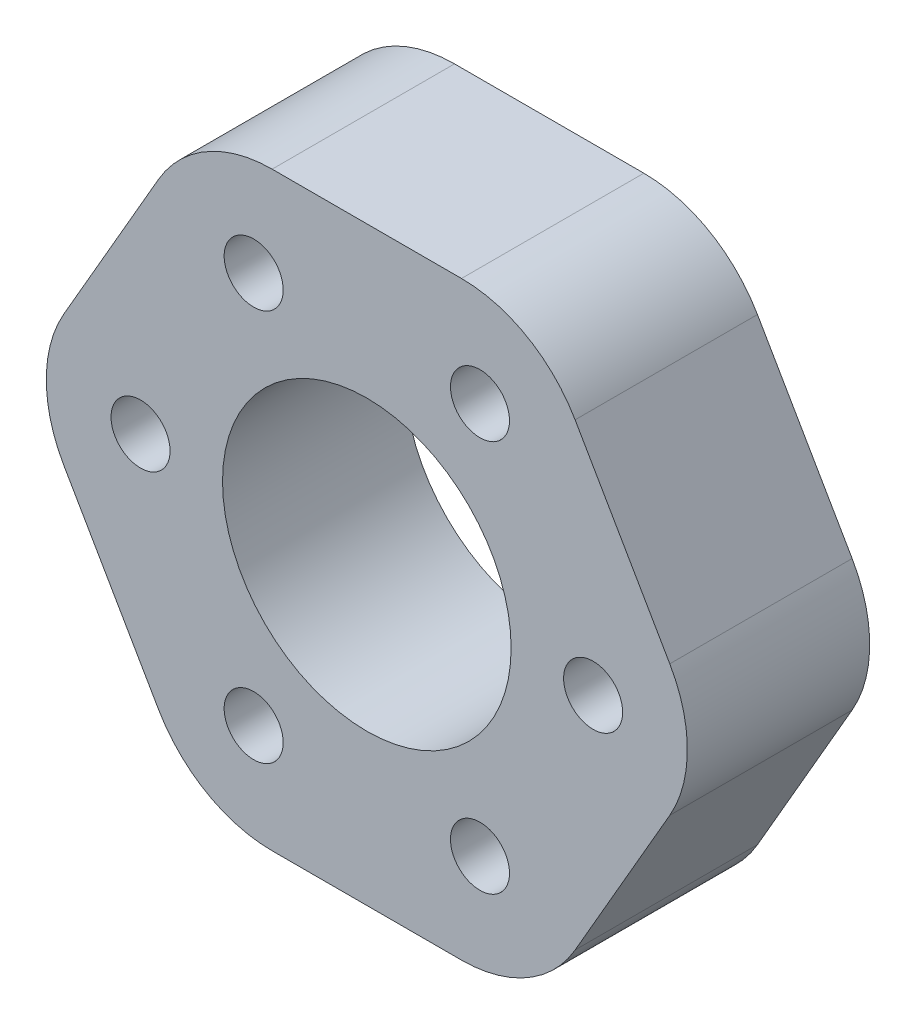
from build123d import *

# Parameters (mm, degrees)
SKETCH_1_R          = 29.4
SKETCH_1_R_2        = 2.25
EXTRUDE_1_DEPTH     = 13.9
SKETCH_2_OUTSIDE_W  = 77.662
SKETCH_2_OUTSIDE_H  = 77.662
SKETCH_2_OUTSIDE_R  = 11
CUT_EXTRUDE_1_DEPTH = 44.83982208
FILLET_1_R          = 10


with BuildPart() as part:
    # 草图1 → 凸台-拉伸1 (new body)
    with BuildSketch(Plane.XY):
        Circle(SKETCH_1_R)
        with Locations((-17.25, 0)):
            Circle(SKETCH_1_R_2, mode=Mode.SUBTRACT)
        with Locations((-8.625, 14.938938215)):
            Circle(SKETCH_1_R_2, mode=Mode.SUBTRACT)
        with Locations((8.625, 14.938938215)):
            Circle(SKETCH_1_R_2, mode=Mode.SUBTRACT)
        with Locations((17.25, 0)):
            Circle(SKETCH_1_R_2, mode=Mode.SUBTRACT)
        with Locations((8.625, -14.938938215)):
            Circle(SKETCH_1_R_2, mode=Mode.SUBTRACT)
        with Locations((-8.625, -14.938938215)):
            Circle(SKETCH_1_R_2, mode=Mode.SUBTRACT)
    extrude(amount=EXTRUDE_1_DEPTH)

    # 草图2 outside → 切除-拉伸1 (cut, through all)
    # profile 1 of 2: a face of its own
    with BuildSketch(Plane.XY.offset(13.9)):
        Rectangle(SKETCH_2_OUTSIDE_W, SKETCH_2_OUTSIDE_H)
        Polygon((12.990381057, 22.5), (-12.990381057, 22.5), (-25.980762114, 0), (-12.990381057, -22.5), (12.990381057, -22.5), (25.980762114, 0), align=None, mode=Mode.SUBTRACT)
    # profile 2 of 2: a face of its own
    with BuildSketch(Plane.XY.offset(13.9)):
        Circle(SKETCH_2_OUTSIDE_R)
    extrude(amount=-CUT_EXTRUDE_1_DEPTH, mode=Mode.SUBTRACT)

    # 圆角1
    fillet_1_edges = [part.edges().sort_by_distance(p)[0] for p in [
        (25.980762114, 0, 6.95),
        (12.990381057, -22.5, 6.95),
        (-12.990381057, -22.5, 6.95),
        (-25.980762114, 0, 6.95),
        (-12.990381057, 22.5, 6.95),
        (12.990381057, 22.5, 6.95),
    ]]
    fillet(fillet_1_edges, radius=FILLET_1_R)


solid = part.part
